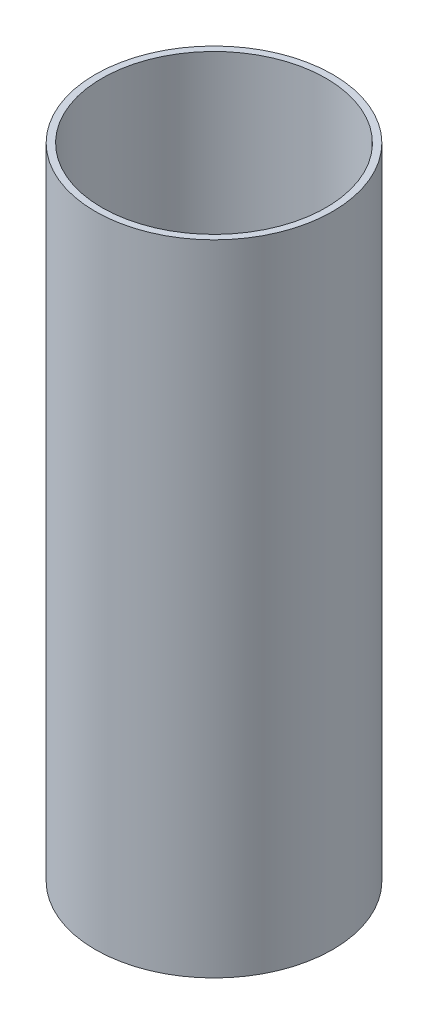
from build123d import *

# Parameters (mm, degrees)
SKETCH1_R           = 6.5
SKETCH1_R_2         = 6.135
BOSS_EXTRUDE1_DEPTH = 35


with BuildPart() as part:
    # Sketch1 → Boss-Extrude1 (new body)
    with BuildSketch(Plane(origin=(0, 0, 0), x_dir=(1, 0, 0), z_dir=(0, 1, 0))):
        with Locations(Location((0, 0, 0), (0, 0, 270))):
            Circle(SKETCH1_R)
        with Locations(Location((0, 0, 0), (0, 0, 270))):
            Circle(SKETCH1_R_2, mode=Mode.SUBTRACT)
    extrude(amount=BOSS_EXTRUDE1_DEPTH)


solid = part.part
